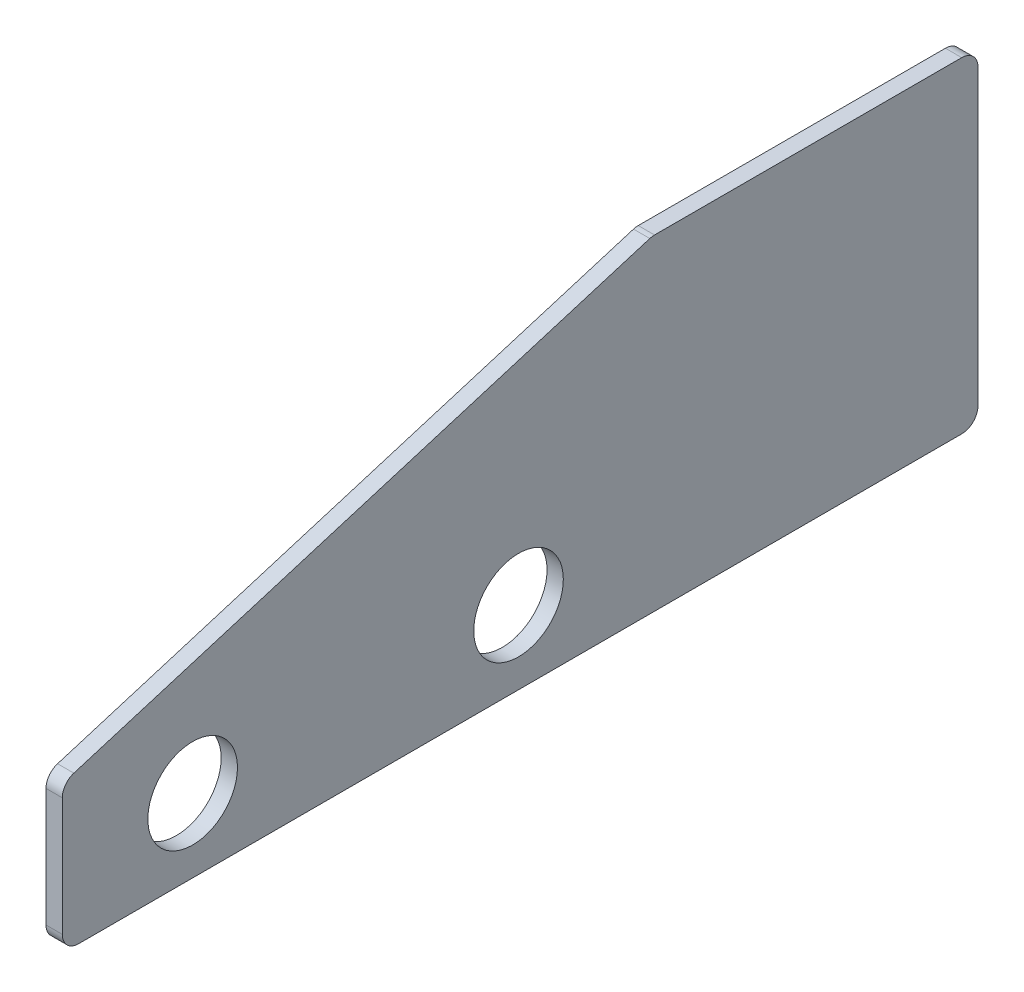
from build123d import *

# Parameters (mm, degrees)
BOSS_EXTRUDE1_DEPTH      = 0.5
BOSS_EXTRUDE1_DEPTH_BACK = 0.5
FILLET1_R                = 1
SKETCH2_R                = 2.75
CUT_EXTRUDE1_DEPTH       = 60.661042565


with BuildPart() as part:
    # Sketch1 → Boss-Extrude1 (new, two sides: drawn at the far end of the back side and taken through both)
    with BuildSketch(Plane(origin=(0, 0, 0), x_dir=(0, 0, -1), z_dir=(1, 0, 0)).offset(-BOSS_EXTRUDE1_DEPTH_BACK)):
        Polygon((0, 0), (56.2, 0), (56.2, 20), (36.2, 20), (0, 9), align=None)
    extrude(amount=BOSS_EXTRUDE1_DEPTH + BOSS_EXTRUDE1_DEPTH_BACK)

    # Fillet1
    fillet1_edges = [part.edges().sort_by_distance(p)[0] for p in [
        (0, 20, -36.2),
        (0, 20, -56.2),
        (0, 0, -56.2),
        (0, 0, 0),
        (0, 9, 0),
    ]]
    fillet(fillet1_edges, radius=FILLET1_R)

    # Sketch2 → Cut-Extrude1 (cut, through all)
    with BuildSketch(Plane(origin=(0.5, 0, 0), x_dir=(0, 0, -1), z_dir=(1, 0, 0))):
        with Locations((8, 4.5)):
            Circle(SKETCH2_R)
        with Locations((28, 4.5)):
            Circle(SKETCH2_R)
    extrude(amount=-CUT_EXTRUDE1_DEPTH, mode=Mode.SUBTRACT)


solid = part.part
